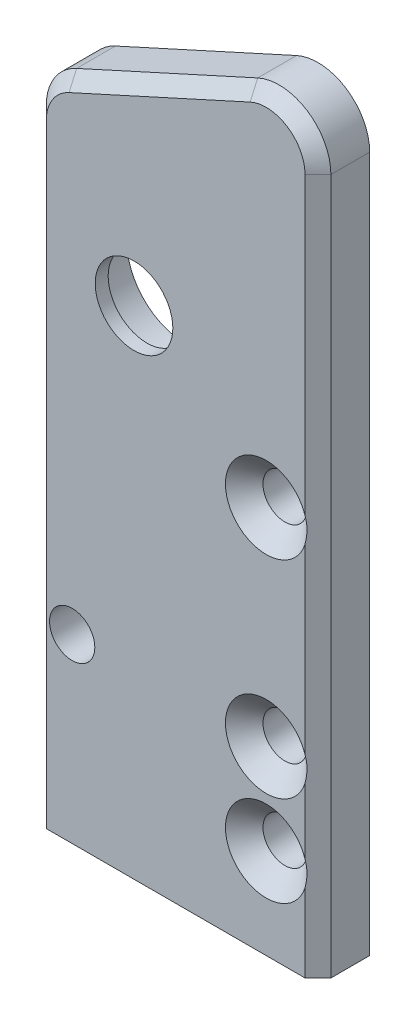
from build123d import *

# Parameters (mm, degrees)
RESSALTO_EXTRUS_O1_DEPTH                             = 4
FILETE1_R                                            = 4
CHANFRO1_SIZE                                        = 1
FURO_DE_DI_METRO_6_0_6_1_D                           = 6
ESCAREADO_PARA_PARAFUSO_COM_CABE_A_ESCAR_D           = 3.4
ESCAREADO_PARA_PARAFUSO_COM_CABE_A_ESCAR_CSINK_D     = 6.3
ESCAREADO_PARA_PARAFUSO_COM_CABE_A_ESCAR_CSINK_ANGLE = 90
BROCA_DE_ROSQUEAR_PARA_TARRAXA_DE_M21_D              = 1.6
BROCA_DE_ROSQUEAR_PARA_TARRAXA_DE_M21_DEPTH          = 10
BROCA_DE_ROSQUEAR_PARA_TARRAXA_DE_M21_TIP            = 0.480688495
ESCAREADO_PARA_PARAFUSO_COM_CABE_A_E_2_D             = 3.4
ESCAREADO_PARA_PARAFUSO_COM_CABE_A_E_2_DEPTH         = 4
ESCAREADO_PARA_PARAFUSO_COM_CABE_A_E_2_CSINK_D       = 6.3
ESCAREADO_PARA_PARAFUSO_COM_CABE_A_E_2_CSINK_ANGLE   = 90
ESCAREADO_PARA_PARAFUSO_COM_CABE_A_E_2_TIP           = 1.021463052
ESBO_O10_R                                           = 4.55
CORTE_EXTRUS_O1_DEPTH                                = 3
FURO_DE_DI_METRO_3_5_3_5_1_D                         = 3.5


with BuildPart() as part:
    # Esboço1 → Ressalto-extrusão1 (new body)
    with BuildSketch(Plane.XY):
        Polygon((0, 0), (22, 0), (22, 60), (0, 50), align=None)
    extrude(amount=RESSALTO_EXTRUS_O1_DEPTH)

    # Filete1
    filete1_edges = [part.edges().sort_by_distance(p)[0] for p in [
        (0, 50, 2),
        (22, 60, 2),
    ]]
    fillet(filete1_edges, radius=FILETE1_R)

    # Chanfro1
    chanfro1_edges = [part.edges().sort_by_distance(p)[0] for p in [
        (22, 26.893991641, 4),
        (0, 23.712173459, 4),
        (9.344788223, 54.24763101, 4),
        (20.165542991, 57.151080598, 4),
        (0.636902684, 49.58988991, 4),
    ]]
    chamfer(chanfro1_edges, length=CHANFRO1_SIZE)

    # Furo de diâmetro Ø6.0 (6)1 (through all)
    with Locations(Plane(origin=(7.780869527, 38.393713373, 4), x_dir=(1, 0, 0), z_dir=(0, 0, 1))):
        with Locations((0, 0)):
            Hole(FURO_DE_DI_METRO_6_0_6_1_D / 2)

    # Escareado para parafuso com cabe_a escar (through all)
    with Locations(Plane(origin=(18, 7, 4), x_dir=(1, 0, 0), z_dir=(0, 0, 1))):
        with Locations((0, 0), (0, 7)):
            CounterSinkHole(ESCAREADO_PARA_PARAFUSO_COM_CABE_A_ESCAR_D / 2, ESCAREADO_PARA_PARAFUSO_COM_CABE_A_ESCAR_CSINK_D / 2, counter_sink_angle=ESCAREADO_PARA_PARAFUSO_COM_CABE_A_ESCAR_CSINK_ANGLE)

    # Broca de rosquear para tarraxa de M21
    with Locations(Plane(origin=(4, 0, 2), x_dir=(0, 0, -1), z_dir=(0, -1, 0))):
        with Locations((0, 0), (0, 8)):
            Hole(BROCA_DE_ROSQUEAR_PARA_TARRAXA_DE_M21_D / 2, depth=BROCA_DE_ROSQUEAR_PARA_TARRAXA_DE_M21_DEPTH)
            with Locations((0, 0, -(BROCA_DE_ROSQUEAR_PARA_TARRAXA_DE_M21_DEPTH + BROCA_DE_ROSQUEAR_PARA_TARRAXA_DE_M21_TIP / 2))):  # 118° drill point
                Cone(0, BROCA_DE_ROSQUEAR_PARA_TARRAXA_DE_M21_D / 2, BROCA_DE_ROSQUEAR_PARA_TARRAXA_DE_M21_TIP, mode=Mode.SUBTRACT)

    # Escareado para parafuso com cabe_a e 2
    with Locations(Plane(origin=(18, 30, 4), x_dir=(1, 0, 0), z_dir=(0, 0, 1))):
        with Locations((0, 0)):
            CounterSinkHole(ESCAREADO_PARA_PARAFUSO_COM_CABE_A_E_2_D / 2, ESCAREADO_PARA_PARAFUSO_COM_CABE_A_E_2_CSINK_D / 2, depth=ESCAREADO_PARA_PARAFUSO_COM_CABE_A_E_2_DEPTH, counter_sink_angle=ESCAREADO_PARA_PARAFUSO_COM_CABE_A_E_2_CSINK_ANGLE)
            with Locations((0, 0, -(ESCAREADO_PARA_PARAFUSO_COM_CABE_A_E_2_DEPTH + ESCAREADO_PARA_PARAFUSO_COM_CABE_A_E_2_TIP / 2))):  # 118° drill point
                Cone(0, ESCAREADO_PARA_PARAFUSO_COM_CABE_A_E_2_D / 2, ESCAREADO_PARA_PARAFUSO_COM_CABE_A_E_2_TIP, mode=Mode.SUBTRACT)

    # Esboço10 → Corte-extrusão1 (cut)
    with BuildSketch(Plane(origin=(0, 0, 0), x_dir=(-1, 0, 0), z_dir=(0, 0, -1))):
        with Locations((-7.780869527, 38.393713373)):
            Circle(ESBO_O10_R)
    extrude(amount=-CORTE_EXTRUS_O1_DEPTH, mode=Mode.SUBTRACT)

    # Furo de diâmetro Ø3.5 (3.5)1 (through all)
    with Locations(Plane(origin=(3, 14, 4), x_dir=(1, 0, 0), z_dir=(0, 0, 1))):
        with Locations((0, 0)):
            Hole(FURO_DE_DI_METRO_3_5_3_5_1_D / 2)


solid = part.part
